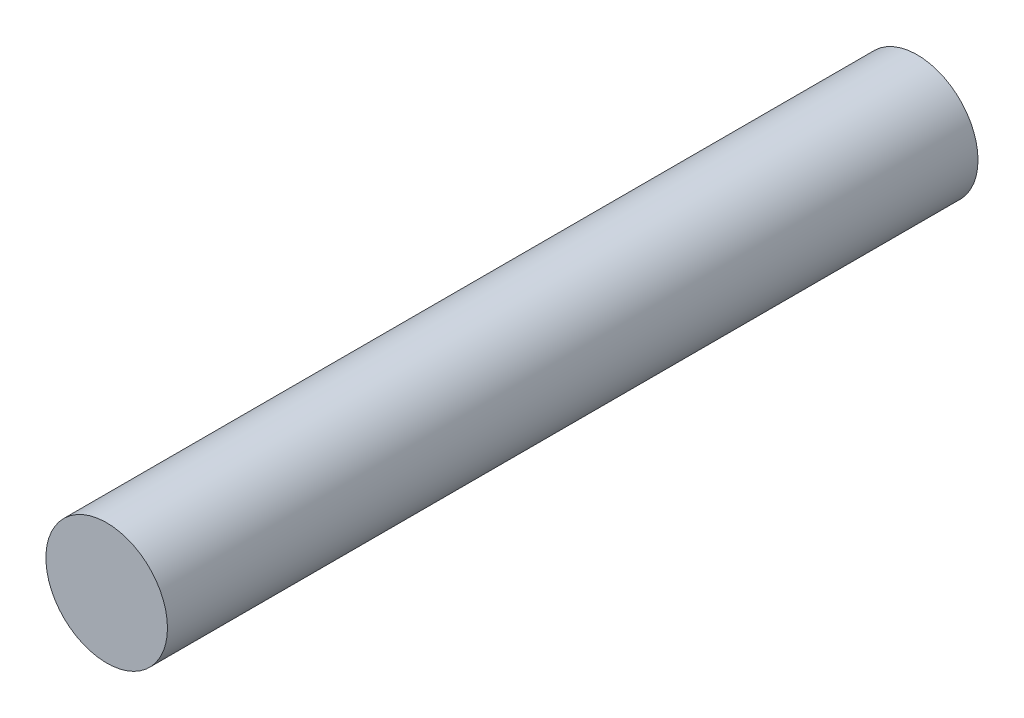
from build123d import *

# Parameters (mm, degrees)
ESBO_O1_R                = 1.5
RESSALTO_EXTRUS_O1_DEPTH = 20


with BuildPart() as part:
    # Esboço1 → Ressalto-extrusão1 (new body)
    with BuildSketch(Plane.XY):
        Circle(ESBO_O1_R)
    extrude(amount=RESSALTO_EXTRUS_O1_DEPTH)


solid = part.part
